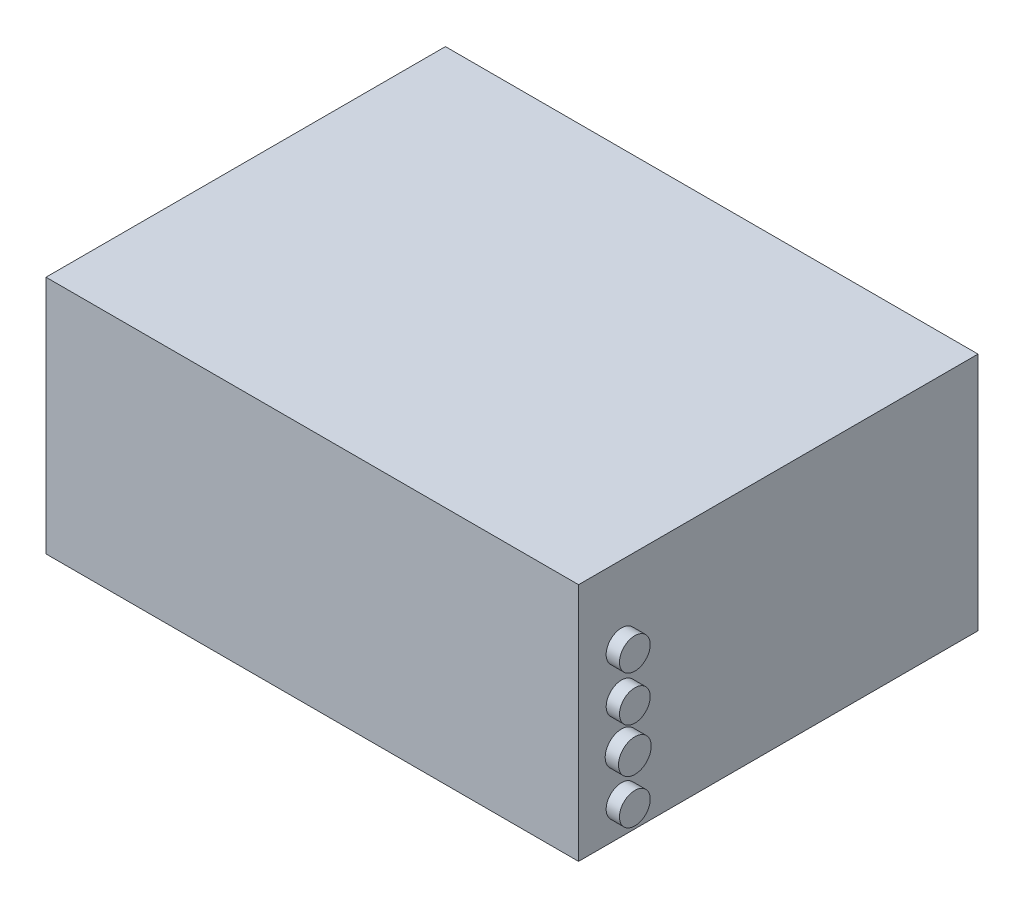
from build123d import *

# Parameters (mm, degrees)
SKETCH1_W           = 200
SKETCH1_H           = 150
BOSS_EXTRUDE1_DEPTH = 90
SKETCH2_R           = 5.778007253
SKETCH2_R_2         = 6.144226379
SKETCH2_R_3         = 5.765469067
SKETCH2_R_4         = 5.780094306
BOSS_EXTRUDE2_DEPTH = 5
BOSS_EXTRUDE3_START = -205
SKETCH2_2_R         = 5.778007253
SKETCH2_2_R_2       = 6.144226379
SKETCH2_2_R_3       = 5.765469067
SKETCH2_2_R_4       = 5.780094306
BOSS_EXTRUDE3_DEPTH = 5


with BuildPart() as part:
    # Sketch1 → Boss-Extrude1 (new body)
    with BuildSketch(Plane(origin=(0, 0, 0), x_dir=(1, 0, 0), z_dir=(0, 1, 0))):
        Rectangle(SKETCH1_W, SKETCH1_H)
    extrude(amount=BOSS_EXTRUDE1_DEPTH)

    # Sketch2 → Boss-Extrude2 (add)
    with BuildSketch(Plane.ZY.offset(100)):
        with Locations((58.863929125, 11.762847407)):
            Circle(SKETCH2_R)
        with Locations((58.863929125, 28.847365095)):
            Circle(SKETCH2_R_2)
        with Locations((58.863929125, 45.155313797)):
            Circle(SKETCH2_R_3)
        with Locations((58.863929125, 62.084517688)):
            Circle(SKETCH2_R_4)
    extrude(amount=BOSS_EXTRUDE2_DEPTH)

    # Sketch2<2> → Boss-Extrude3 (add)
    with BuildSketch(Plane.ZY.offset(100).offset(BOSS_EXTRUDE3_START)):
        with Locations((58.863929125, 11.762847407)):
            Circle(SKETCH2_2_R)
        with Locations((58.863929125, 28.847365095)):
            Circle(SKETCH2_2_R_2)
        with Locations((58.863929125, 45.155313797)):
            Circle(SKETCH2_2_R_3)
        with Locations((58.863929125, 62.084517688)):
            Circle(SKETCH2_2_R_4)
    extrude(amount=BOSS_EXTRUDE3_DEPTH)


solid = part.part
